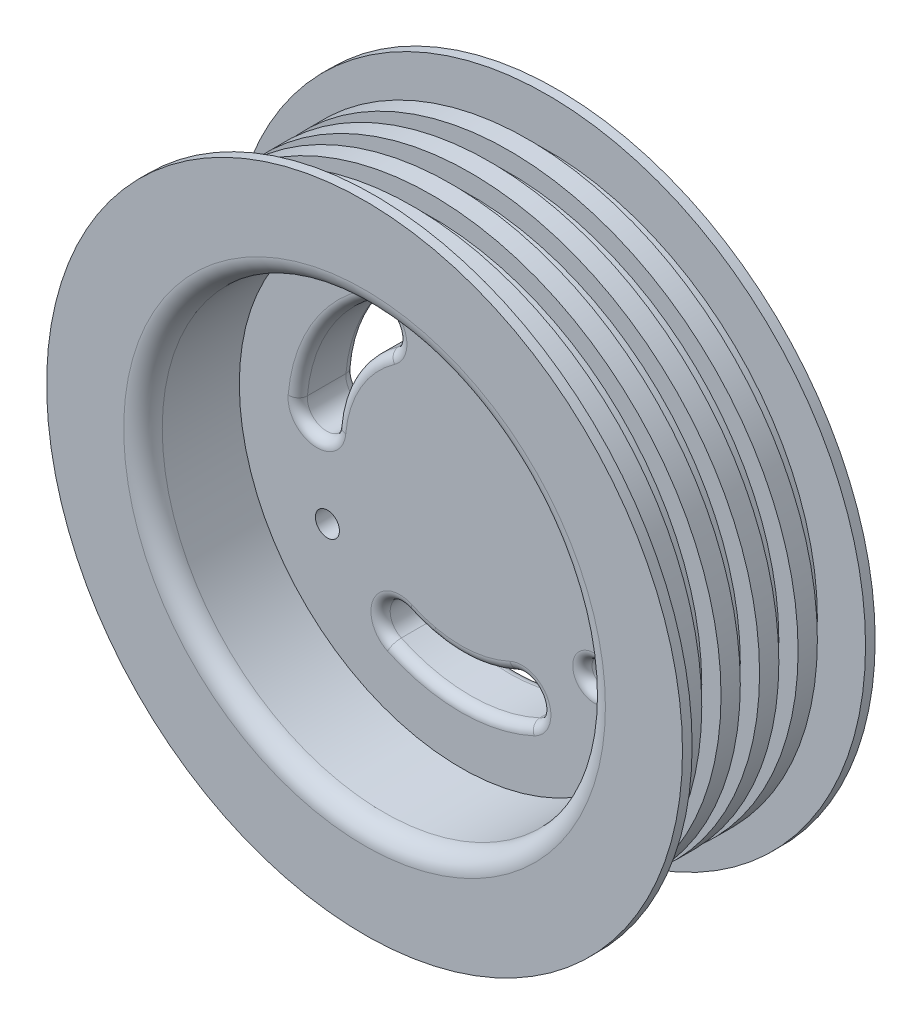
from build123d import *

# Parameters (mm, degrees)
SKETCH1_R                         = 33
BOSS_EXTRUDE1_DEPTH               = 20
SHELL1_T                          = -10
SKETCH2_W                         = 3
SKETCH2_H                         = 18
SKETCH3_W                         = 2
SKETCH3_H                         = 2
LPATTERN1_COUNT                   = 5
LPATTERN1_PITCH                   = 4
SKETCH5_R                         = 23
CUT_EXTRUDE1_DEPTH                = 4
TAP_DRILL_FOR_M3_TAP1_D           = 2.5
TAP_DRILL_FOR_M3_TAP1_CSINK_D     = 2.55
TAP_DRILL_FOR_M3_TAP1_CSINK_ANGLE = 90
SKETCH9_R                         = 5
CUT_EXTRUDE2_DEPTH                = 9
CHAMFER1_SIZE                     = 1
CUT_EXTRUDE3_DEPTH                = 50.335585534
CIRPATTERN1_COUNT                 = 3
FILLET1_R                         = 1
FILLET2_R                         = 1
FILLET3_R                         = 2


with BuildPart() as part:
    # Sketch1 → Boss-Extrude1 (new body)
    with BuildSketch(Plane.XY):
        Circle(SKETCH1_R)
    extrude(amount=BOSS_EXTRUDE1_DEPTH)

    # Shell1
    shell1_openings = [part.faces().sort_by_distance(p)[0] for p in [
        (0, 0, 20),
    ]]
    offset(amount=SHELL1_T, openings=shell1_openings, kind=Kind.INTERSECTION)

    # Sketch2 → Cut-Revolve1 (revolve, cut)
    with BuildSketch(Plane(origin=(0, 0, 0), x_dir=(1, 0, 0), z_dir=(0, 1, 0))):
        with Locations((31.5, -10)):
            Rectangle(SKETCH2_W, SKETCH2_H)
    revolve(axis=Axis((0, 0, 20), (0, 0, -1)), mode=Mode.SUBTRACT)

    # Sketch3 → Cut-Revolve2 (revolve, cut)
    with BuildSketch(Plane(origin=(0, 0, 0), x_dir=(1, 0, 0), z_dir=(0, 1, 0))):
        with Locations((29, -2)):
            Rectangle(SKETCH3_W, SKETCH3_H)
    cut_revolve2 = revolve(axis=Axis((0, 0, 20), (0, 0, -1)), mode=Mode.SUBTRACT)

    # LPattern1: Cut-Revolve2 ×5
    with Locations(*[(0, 0, i * LPATTERN1_PITCH) for i in range(1, LPATTERN1_COUNT)]):
        add(cut_revolve2, mode=Mode.SUBTRACT)

    # Sketch5 → Cut-Extrude1 (cut)
    with BuildSketch(Plane.XY):
        Circle(SKETCH5_R)
        with BuildLine():
            Line((-16.454482672, -6.5), (-2.598076211, 17.5))
            ThreePointArc((-2.598076211, 17.5), (0, 19), (2.598076211, 17.5))
            Line((2.598076211, 17.5), (16.454482672, -6.5))
            ThreePointArc((16.454482672, -6.5), (16.454482672, -9.5), (13.856406461, -11))
            Line((13.856406461, -11), (-13.856406461, -11))
            ThreePointArc((-13.856406461, -11), (-16.454482672, -9.5), (-16.454482672, -6.5))
        make_face(mode=Mode.SUBTRACT)
    extrude(amount=CUT_EXTRUDE1_DEPTH, mode=Mode.SUBTRACT)

    # Tap Drill for M3 Tap1 (through all)
    with Locations(Plane(origin=(0, 0, 0), x_dir=(-1, 0, 0), z_dir=(0, 0, -1))):
        with Locations((0, 16), (13.856406461, -8), (-13.856406461, -8)):
            CounterSinkHole(TAP_DRILL_FOR_M3_TAP1_D / 2, TAP_DRILL_FOR_M3_TAP1_CSINK_D / 2, counter_sink_angle=TAP_DRILL_FOR_M3_TAP1_CSINK_ANGLE)

    # Sketch9 → Cut-Extrude2 (cut)
    with BuildSketch(Plane(origin=(0, 0, 0), x_dir=(-1, 0, 0), z_dir=(0, 0, -1))):
        Circle(SKETCH9_R)
    extrude(amount=-CUT_EXTRUDE2_DEPTH, mode=Mode.SUBTRACT)

    # Chamfer1
    chamfer1_edges = [part.edges().sort_by_distance(p)[0] for p in [
        (5, 0, 0),
    ]]
    chamfer(chamfer1_edges, length=CHAMFER1_SIZE)

    # Sketch10 → Cut-Extrude3 (cut, through all)
    with BuildSketch(Plane(origin=(0, 0, 4), x_dir=(-1, 0, 0), z_dir=(0, 0, -1))):
        with BuildLine():
            ThreePointArc((16.935309868, 1.481647627), (14.722431864, 8.5), (9.750799418, 13.925584753))
            ThreePointArc((9.750799418, 13.925584753), (6.965342457, 13.434433537), (7.456493673, 10.648976576))
            ThreePointArc((7.456493673, 10.648976576), (11.258330249, 6.5), (12.950531075, 1.133024656))
            ThreePointArc((12.950531075, 1.133024656), (15.117231957, -0.685053255), (16.935309868, 1.481647627))
        make_face()
    cut_extrude3 = extrude(amount=-CUT_EXTRUDE3_DEPTH, mode=Mode.SUBTRACT)

    # CirPattern1: Cut-Extrude3 ×3 about axis
    cirpattern1_axis = Axis((0, 0, 0), (0, 0, 1))
    for i in range(1, CIRPATTERN1_COUNT):
        add(cut_extrude3.rotate(cirpattern1_axis, i * 360 / CIRPATTERN1_COUNT), mode=Mode.SUBTRACT)

    # Fillet1
    fillet1_edges = [part.edges().sort_by_distance(p)[0] for p in [
        (-15.117231957, -0.685053255, 10),
        (-11.258330249, 6.5, 10),
        (-6.965342457, 13.434433537, 10),
        (-14.722431864, 8.5, 10),
        (8.1518895, -12.749380282, 10),
        (0, -13, 10),
        (-8.1518895, -12.749380282, 10),
        (0, -17, 10),
        (6.965342457, 13.434433537, 10),
        (11.258330249, 6.5, 10),
        (15.117231957, -0.685053255, 10),
        (14.722431864, 8.5, 10),
        (12.606406461, -8, 10),
        (-1.25, 16, 10),
    ]]
    fillet(fillet1_edges, radius=FILLET1_R)

    # Fillet2
    fillet2_edges = [part.edges().sort_by_distance(p)[0] for p in [
        (-15.117231957, -0.685053255, 4),
        (-14.722431864, 8.5, 4),
        (-6.965342457, 13.434433537, 4),
        (-11.258330249, 6.5, 4),
        (8.1518895, -12.749380282, 4),
        (0, -17, 4),
        (-8.1518895, -12.749380282, 4),
        (0, -13, 4),
        (6.965342457, 13.434433537, 4),
        (14.722431864, 8.5, 4),
        (15.117231957, -0.685053255, 4),
        (11.258330249, 6.5, 4),
    ]]
    fillet(fillet2_edges, radius=FILLET2_R)

    # Fillet3
    fillet3_edges = [part.edges().sort_by_distance(p)[0] for p in [
        (-23, 0, 20),
    ]]
    fillet(fillet3_edges, radius=FILLET3_R)


solid = part.part
